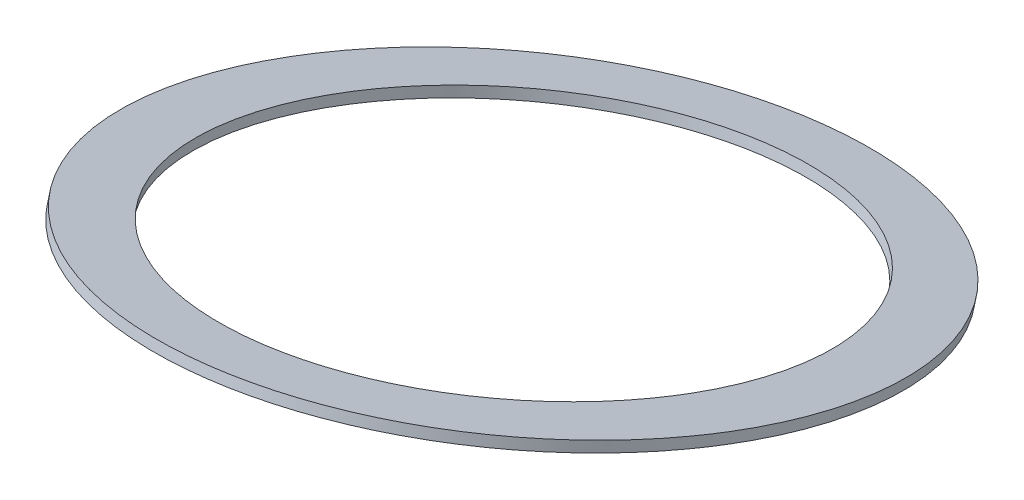
from build123d import *

# Parameters (mm, degrees)
BOSS_EXTRUDE1_DEPTH = 7


with BuildPart() as part:
    # Sketch1 → Boss-Extrude1 (new body)
    with BuildSketch(Plane(origin=(0, 161.186250329, -43.189725607), x_dir=(-1.0, -1.4278956929826476e-12, 3.826034978110988e-13), z_dir=(1.4782663990552186e-12, -0.9659258262889804, 0.25881904510284903))):
        with BuildLine():
            add(Edge.make_bspline(
                [(-306.172324205, -512.562907386), (-304.34789887, -519.792342579), (-300.181465314, -534.044087381), (-292.344724915, -554.83964043), (-282.86937543, -575.007224868), (-271.571170782, -594.59262595), (-258.68195276, -612.945699759), (-246.534327869, -627.201881407), (-235.911531853, -637.915604089), (-227.432674655, -645.612044112), (-218.544747077, -652.834670418), (-206.227945191, -661.741360611), (-193.160898286, -669.565162801), (-179.302732627, -676.204349518), (-164.860262144, -682.007836215), (-146.416027588, -687.36695687), (-127.414909646, -690.202782235), (-111.846517313, -690.875446006), (-96.212571889, -690.437816785), (-80.932636117, -688.38579557), (-65.935303926, -684.791167441), (-54.812477802, -681.314405495), (-43.955965412, -677.109096713), (-30.027483999, -670.65146629), (-13.512324674, -661.038941217), (4.944416742, -647.150944867), (21.459684696, -631.612719281), (33.834356528, -617.362532227), (42.924644481, -605.235021642), (51.365350248, -592.814632045), (60.801793865, -576.715513729), (70.456518889, -556.555745669), (78.51237672, -535.554697291), (84.850070092, -514.27412063), (89.599496595, -492.645046352), (92.796334565, -470.684154214), (94.43581481, -448.39373739), (94.505045168, -426.306361934), (93.047325866, -404.313368321), (90.54621528, -386.075020246), (87.752246948, -371.542249727), (85.241119078, -360.643301049), (82.333808936, -349.867150142), (77.94702026, -335.734864515), (71.494456176, -318.476215806), (62.15416878, -298.438542479), (52.956695131, -282.322080905), (44.676428899, -269.812310601), (35.726485109, -257.555392842), (23.564661223, -243.172304478), (9.998523009, -230.049416786), (-1.751581085, -220.394281349), (-11.080994839, -213.572603365), (-20.763989585, -207.328529297), (-34.108695923, -199.821210106), (-51.599226932, -191.994623616), (-74.156409744, -185.303506959), (-97.035739875, -181.839249484), (-116.397266798, -181.59694831), (-132.046568715, -183.07335824), (-147.355123707, -185.614908614), (-162.242301577, -189.68877069), (-176.705758397, -195.235959383), (-190.839166062, -201.742734901), (-204.082189268, -209.434743585), (-216.571724679, -218.229362109), (-225.568153233, -225.363384501), (-234.174613637, -232.998034951), (-244.974628851, -243.65923384), (-254.875841471, -255.050521442), (-263.928194448, -267.099257672), (-270.32153881, -276.485294911), (-276.260378064, -286.107140865), (-283.564630507, -299.180309295), (-291.611410229, -315.990524669), (-298.29028509, -333.374137898), (-302.848776875, -347.653368043), (-306.839912788, -362.01662235), (-310.799329031, -380.104442983), (-313.97418066, -402.03220109), (-315.603138506, -424.178909325), (-315.666557309, -446.581546374), (-314.163956536, -468.745405235), (-311.614163445, -487.089140009), (-308.779566485, -501.666973201), (-307.084536872, -508.94818979), (-306.172324205, -512.562907386)],
                knots=[0, 0, 0, 0, 0.015625, 0.03125, 0.046875, 0.0625, 0.078125, 0.09375, 0.1015625, 0.109375, 0.1171875, 0.125, 0.140625, 0.1484375, 0.15625, 0.171875, 0.1875, 0.1953125, 0.203125, 0.21875, 0.2265625, 0.234375, 0.2421875, 0.25, 0.265625, 0.28125, 0.296875, 0.3125, 0.3203125, 0.328125, 0.34375, 0.359375, 0.375, 0.390625, 0.40625, 0.421875, 0.4375, 0.453125, 0.46875, 0.484375, 0.4921875, 0.5, 0.5078125, 0.515625, 0.53125, 0.546875, 0.5625, 0.5703125, 0.578125, 0.59375, 0.609375, 0.6171875, 0.625, 0.6328125, 0.640625, 0.65625, 0.671875, 0.6875, 0.703125, 0.7109375, 0.71875, 0.734375, 0.7421875, 0.75, 0.765625, 0.7734375, 0.78125, 0.7890625, 0.796875, 0.8125, 0.8203125, 0.828125, 0.8359375, 0.84375, 0.859375, 0.875, 0.8828125, 0.890625, 0.90625, 0.921875, 0.9375, 0.953125, 0.96875, 0.984375, 0.9921875, 1, 1, 1, 1], degree=3))
        make_face()
        with BuildLine():
            add(Edge.make_bspline(
                [(-266.817639882, -499.019603231), (-265.322265847, -505.096427598), (-261.904126751, -517.062570301), (-255.476658524, -534.477510015), (-247.722819432, -551.306955536), (-238.51295895, -567.579433486), (-228.055722081, -582.755862027), (-218.261656909, -594.475903271), (-209.744164153, -603.244403058), (-202.975387931, -609.520143611), (-195.89697061, -615.400947774), (-186.133902049, -622.625466035), (-175.835181832, -628.946242739), (-164.981263273, -634.296034612), (-153.706102688, -638.972068008), (-139.364744506, -643.299866689), (-121.732847795, -646.112874226), (-103.492125816, -646.407936292), (-88.669065868, -644.518687455), (-76.990288579, -641.792217589), (-68.297437009, -639.123472423), (-59.779630444, -635.868201204), (-48.801296531, -630.829217391), (-35.691632451, -623.256880083), (-20.899069096, -612.184086178), (-7.537785778, -599.66576754), (2.571465044, -588.066296028), (10.03370791, -578.143285122), (16.987930121, -567.945987078), (24.810803274, -554.655718412), (32.87272111, -537.905213943), (39.633941863, -520.391489564), (44.986861743, -502.58078121), (49.030339298, -484.413163359), (51.321708227, -469.013724368), (52.508478606, -456.517925692), (53.250474071, -444.057065055), (53.364348662, -428.530623827), (52.219317123, -409.989776545), (50.190168591, -394.614695772), (47.906210171, -382.374201124), (45.161219828, -370.14148919), (40.927113912, -355.190552017), (34.580033431, -337.85295851), (26.935605734, -321.124923342), (19.433755199, -307.725313178), (12.702515424, -297.357963727), (5.452419194, -287.235820588), (-4.352931521, -275.410978914), (-15.218646421, -264.682679788), (-24.575946323, -256.823557001), (-34.443224275, -249.441163068), (-47.381560643, -241.43515004), (-63.805011798, -233.871312717), (-81.339695893, -228.470376648), (-99.042794026, -225.615362029), (-114.025775767, -225.30105322), (-126.154437265, -226.355959739), (-138.036681652, -228.250275909), (-152.538183967, -232.124466641), (-169.496979622, -239.206473779), (-182.642271214, -246.786669577), (-192.627314083, -253.780592931), (-199.863805816, -259.494615737), (-206.800520024, -265.625187182), (-215.55108834, -274.233127387), (-223.634381779, -283.499644068), (-231.073576963, -293.369695073), (-238.105566233, -303.66129173), (-245.970768484, -317.022321368), (-254.02698485, -333.769043818), (-259.6409469, -348.290062193), (-263.484485834, -360.239207352), (-266.855126474, -372.257256648), (-270.223628814, -387.44332867), (-272.955058123, -405.89726319), (-274.395170038, -424.58689173), (-274.521399962, -443.467459188), (-273.339035466, -462.137266948), (-271.26998742, -477.588683408), (-268.953853179, -489.857490173), (-267.5653269, -495.981191048), (-266.817639882, -499.019603231)],
                knots=[0, 0, 0, 0, 0.015625, 0.03125, 0.046875, 0.0625, 0.078125, 0.09375, 0.1015625, 0.109375, 0.1171875, 0.125, 0.140625, 0.1484375, 0.15625, 0.171875, 0.1875, 0.203125, 0.21875, 0.2265625, 0.234375, 0.2421875, 0.25, 0.265625, 0.28125, 0.296875, 0.3125, 0.3203125, 0.328125, 0.34375, 0.359375, 0.375, 0.390625, 0.40625, 0.421875, 0.4296875, 0.4375, 0.453125, 0.46875, 0.484375, 0.4921875, 0.5, 0.515625, 0.53125, 0.546875, 0.5625, 0.5703125, 0.578125, 0.59375, 0.609375, 0.6171875, 0.625, 0.640625, 0.65625, 0.671875, 0.6875, 0.703125, 0.7109375, 0.71875, 0.734375, 0.75, 0.765625, 0.7734375, 0.78125, 0.7890625, 0.796875, 0.8125, 0.8203125, 0.828125, 0.84375, 0.859375, 0.875, 0.8828125, 0.890625, 0.90625, 0.921875, 0.9375, 0.953125, 0.96875, 0.984375, 0.9921875, 1, 1, 1, 1], degree=3))
        make_face(mode=Mode.SUBTRACT)
    extrude(amount=BOSS_EXTRUDE1_DEPTH)


solid = part.part
